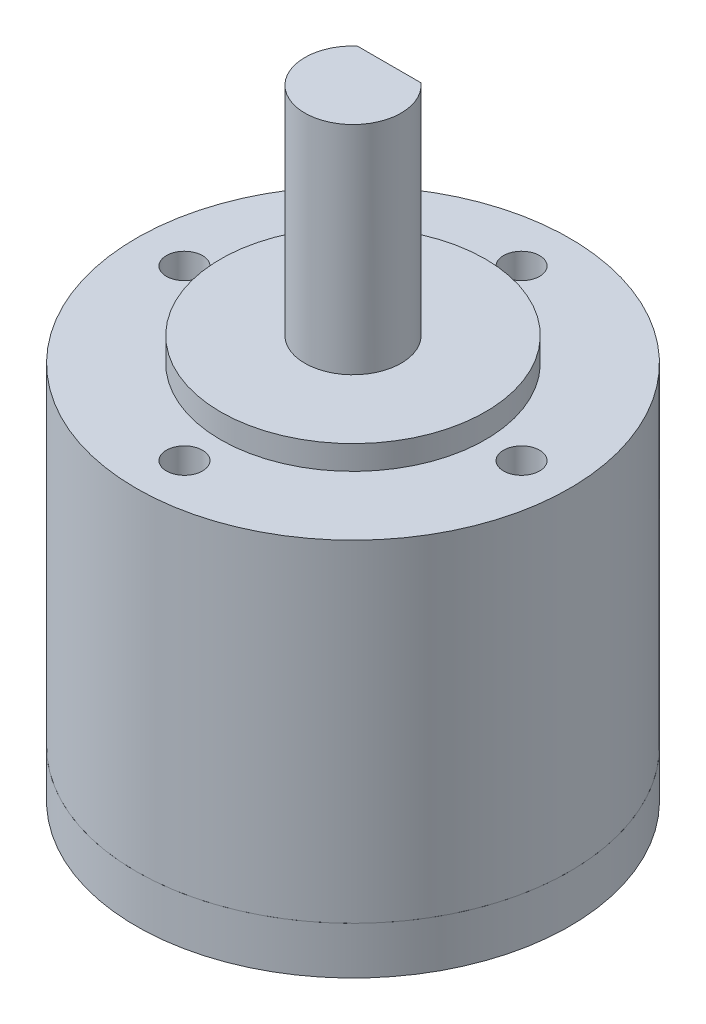
from build123d import *

# Parameters (mm, degrees)
SKETCH1_R           = 18
BOSS_EXTRUDE1_DEPTH = 13.7795
SKETCH2_R           = 11
BOSS_EXTRUDE2_DEPTH = 2
SKETCH3_R           = 4
BOSS_EXTRUDE4_DEPTH = 18
CUT_EXTRUDE1_START  = -15
CUT_EXTRUDE1_DEPTH  = 15
SKETCH5_R           = 1.5
CUT_EXTRUDE2_DEPTH  = 38.51664272
SKETCH6_R           = 11.178
CUT_EXTRUDE3_DEPTH  = 20
SKETCH7_R           = 18
BOSS_EXTRUDE5_DEPTH = 3.937
SKETCH8_R           = 10.9855
BOSS_EXTRUDE6_DEPTH = 2.413
SKETCH9_R           = 1.265
CUT_EXTRUDE4_DEPTH  = 54.94310411
SKETCH10_R          = 4
CUT_EXTRUDE5_DEPTH  = 52.82819036
SKETCH11_R          = 4.75
CUT_EXTRUDE6_DEPTH  = 0.6


with BuildPart() as part:
    # Sketch1 → Boss-Extrude1 (new, symmetric)
    with BuildSketch(Plane(origin=(0, 0, 0), x_dir=(1, 0, 0), z_dir=(0, 1, 0))):
        with Locations(Location((0, 0, 0), (0, 0, 270))):
            Circle(SKETCH1_R)
    extrude(amount=BOSS_EXTRUDE1_DEPTH, both=True)

    # Sketch2 → Boss-Extrude2 (add)
    with BuildSketch(Plane(origin=(0, 13.7795, 0), x_dir=(1, 0, 0), z_dir=(0, 1, 0))):
        with Locations(Location((0, 0, 0), (0, 0, 270))):
            Circle(SKETCH2_R)
    extrude(amount=BOSS_EXTRUDE2_DEPTH)

    # Sketch3 → Boss-Extrude4 (add)
    with BuildSketch(Plane(origin=(0, 15.7795, 0), x_dir=(1, 0, 0), z_dir=(0, 1, 0))):
        with Locations(Location((0, 0, 0), (0, 0, 270))):
            Circle(SKETCH3_R)
    extrude(amount=BOSS_EXTRUDE4_DEPTH)

    # Sketch4 → Cut-Extrude1 (cut)
    with BuildSketch(Plane(origin=(0, 33.7795, 0), x_dir=(1, 0, 0), z_dir=(0, 1, 0)).offset(CUT_EXTRUDE1_START)):
        with BuildLine():
            Line((-2.645751311, 3), (2.645751311, 3))
            ThreePointArc((2.645751311, 3), (0, 4), (-2.645751311, 3))
        make_face()
    extrude(amount=CUT_EXTRUDE1_DEPTH, mode=Mode.SUBTRACT)

    # Sketch5 → Cut-Extrude2 (cut, through all)
    with BuildSketch(Plane(origin=(0, 13.7795, 0), x_dir=(1, 0, 0), z_dir=(0, 1, 0))):
        with Locations(Location((0, 14, 0), (0, 0, 270))):
            Circle(SKETCH5_R)
        with Locations(Location((-14, 0, 0), (0, 0, 270))):
            Circle(SKETCH5_R)
        with Locations(Location((0, -14, 0), (0, 0, 270))):
            Circle(SKETCH5_R)
        with Locations(Location((14, 0, 0), (0, 0, 270))):
            Circle(SKETCH5_R)
    extrude(amount=-CUT_EXTRUDE2_DEPTH, mode=Mode.SUBTRACT)

    # Sketch6 → Cut-Extrude3 (cut)
    with BuildSketch(Plane.XZ.offset(13.7795)):
        with Locations(Location((0, 0, 0), (0, 0, 270))):
            Circle(SKETCH6_R)
    extrude(amount=-CUT_EXTRUDE3_DEPTH, mode=Mode.SUBTRACT)


with BuildPart() as body_2:
    # Sketch7 → Boss-Extrude5 (new body)
    with BuildSketch(Plane.XZ.offset(13.7795)):
        with Locations(Location((0, 0, 0), (0, 0, 270))):
            Circle(SKETCH7_R)
    extrude(amount=BOSS_EXTRUDE5_DEPTH)

    # Sketch8 → Boss-Extrude6 (add)
    with BuildSketch(Plane(origin=(0, -13.7795, 0), x_dir=(1, 0, 0), z_dir=(0, 1, 0))):
        with Locations(Location((0, 0, 0), (0, 0, 270))):
            Circle(SKETCH8_R)
    extrude(amount=BOSS_EXTRUDE6_DEPTH)

    # Sketch9 → Cut-Extrude4 (cut, through all)
    with BuildSketch(Plane(origin=(0, -13.7795, 0), x_dir=(1, 0, 0), z_dir=(0, 1, 0))):
        with Locations(Location((0, 14, 0), (0, 0, 270))):
            Circle(SKETCH9_R)
        with Locations(Location((14, 0, 0), (0, 0, 270))):
            Circle(SKETCH9_R)
        with Locations(Location((0, -14, 0), (0, 0, 270))):
            Circle(SKETCH9_R)
        with Locations(Location((-14, 0, 0), (0, 0, 270))):
            Circle(SKETCH9_R)
    extrude(amount=-CUT_EXTRUDE4_DEPTH, mode=Mode.SUBTRACT)

    # Sketch10 → Cut-Extrude5 (cut, through all)
    with BuildSketch(Plane(origin=(0, -11.3665, 0), x_dir=(1, 0, 0), z_dir=(0, 1, 0))):
        with Locations(Location((0, 0, 0), (0, 0, 270))):
            Circle(SKETCH10_R)
    extrude(amount=-CUT_EXTRUDE5_DEPTH, mode=Mode.SUBTRACT)

    # Sketch11 → Cut-Extrude6 (cut)
    with BuildSketch(Plane(origin=(0, -11.3665, 0), x_dir=(1, 0, 0), z_dir=(0, 1, 0))):
        with Locations(Location((0, 0, 0), (0, 0, 270))):
            Circle(SKETCH11_R)
    extrude(amount=-CUT_EXTRUDE6_DEPTH, mode=Mode.SUBTRACT)


solid = Compound([part.part, body_2.part])
